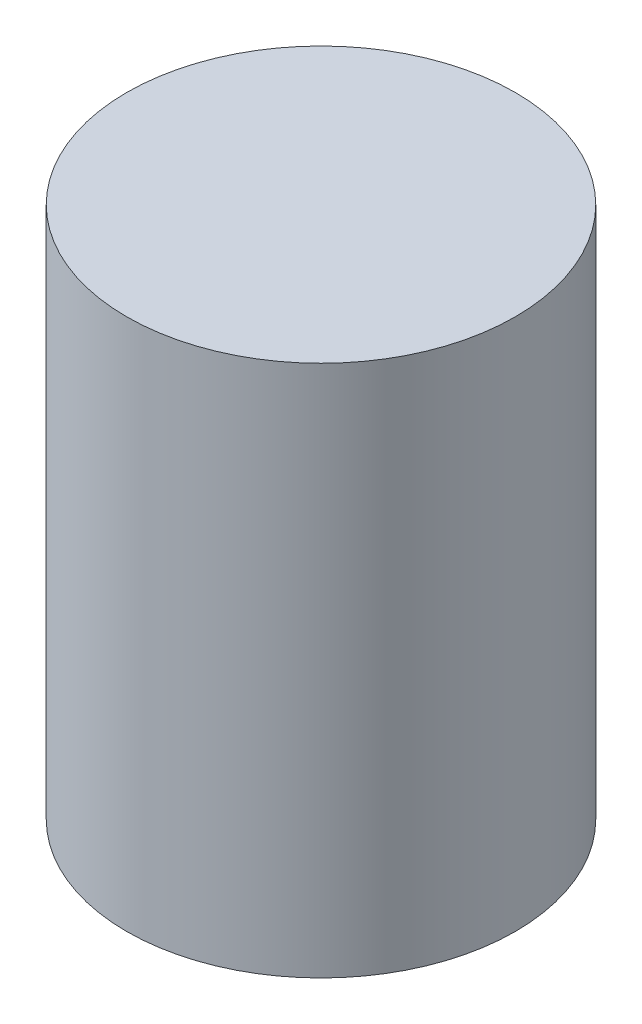
from build123d import *

# Parameters (mm, degrees)
SKETCH3_R           = 1
BOSS_EXTRUDE1_DEPTH = 2.74


with BuildPart() as part:
    # Sketch3 → Boss-Extrude1 (new body)
    with BuildSketch(Plane(origin=(0, 0, 0), x_dir=(1, 0, 0), z_dir=(0, 1, 0))):
        with Locations(Location((0, 0, 0), (0, 0, 270))):
            Circle(SKETCH3_R)
    extrude(amount=BOSS_EXTRUDE1_DEPTH)


solid = part.part
